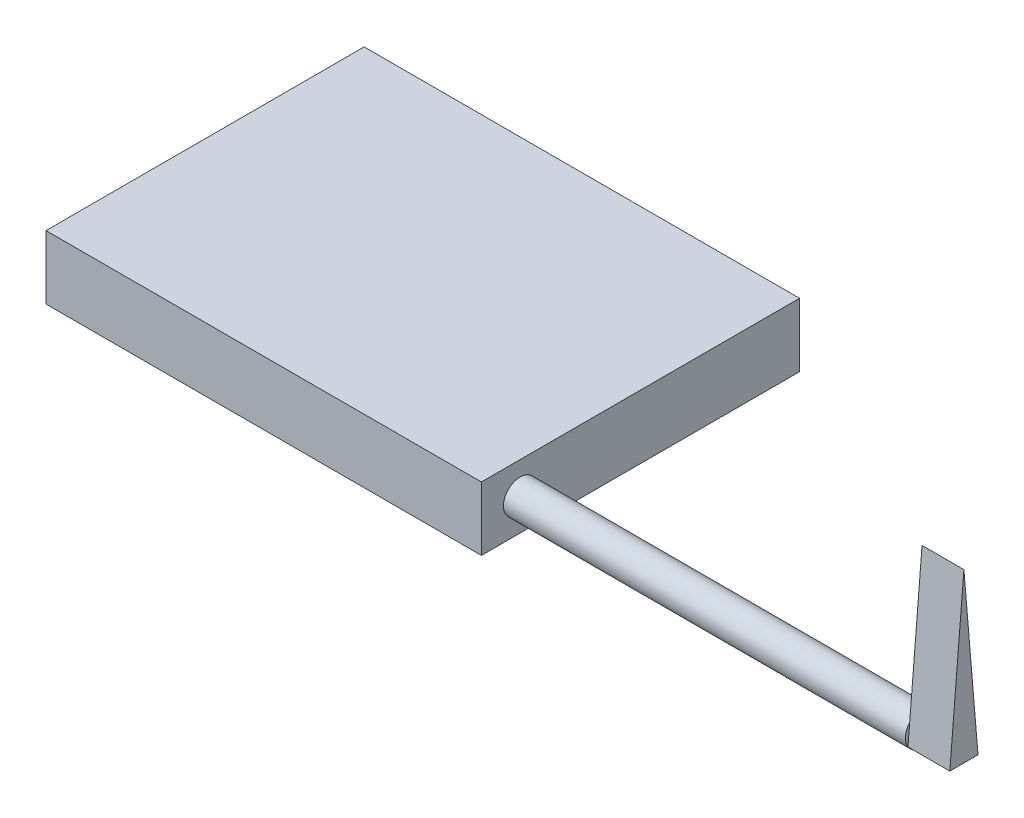
from build123d import *

# Parameters (mm, degrees)
SKETCH1_W           = 52
SKETCH1_H           = 38
BOSS_EXTRUDE1_DEPTH = 7.6
SKETCH2_R           = 2
BOSS_EXTRUDE2_DEPTH = 48
BOSS_EXTRUDE3_DEPTH = 5


with BuildPart() as part:
    # Sketch1 → Boss-Extrude1 (new body)
    with BuildSketch(Plane(origin=(0, 0, 0), x_dir=(1, 0, 0), z_dir=(0, 1, 0))):
        with Locations((-14.781119537, 0)):
            Rectangle(SKETCH1_W, SKETCH1_H)
    extrude(amount=BOSS_EXTRUDE1_DEPTH)

    # Sketch2 → Boss-Extrude2 (add)
    with BuildSketch(Plane(origin=(11.218880463, 0, 0), x_dir=(0, 0, -1), z_dir=(1, 0, 0))):
        with Locations(Location((-14.368237461, 3.8, 0), (0, 0, 180))):
            Circle(SKETCH2_R)
    extrude(amount=BOSS_EXTRUDE2_DEPTH)

    # Sketch3 → Boss-Extrude3 (add)
    with BuildSketch(Plane(origin=(59.218880463, 0, 0), x_dir=(0, 0, -1), z_dir=(1, 0, 0))):
        Polygon((-16.050594412, 2.718484817), (-12.685880511, 2.718484817), (-14.368237461, 22.718484817), align=None)
    extrude(amount=BOSS_EXTRUDE3_DEPTH)


solid = part.part
